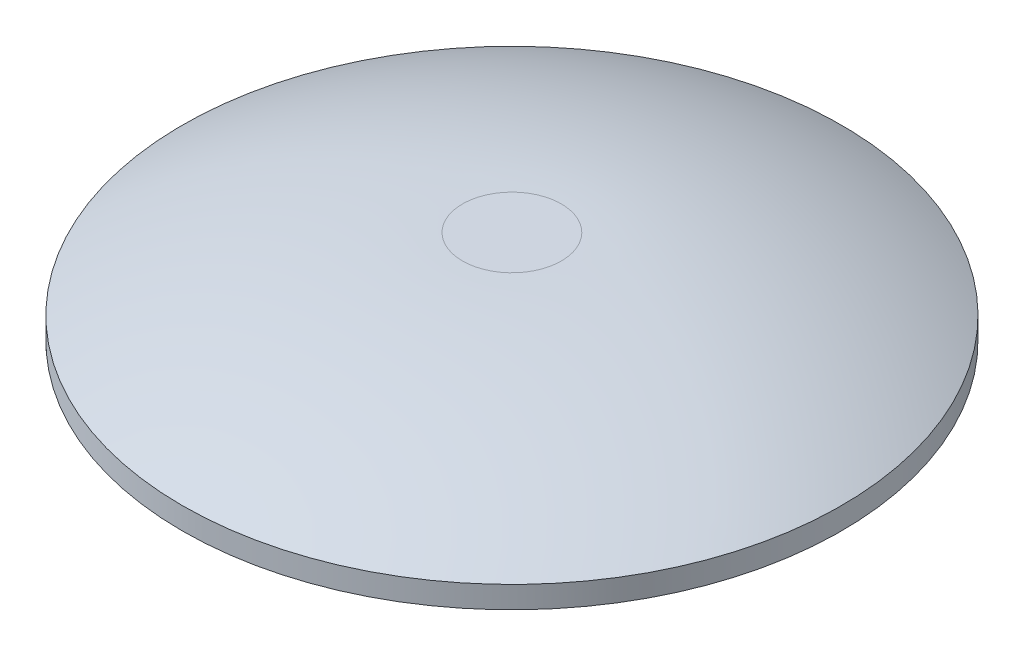
from build123d import *


with BuildPart() as part:
    # Sketch1 → Revolve1 (revolve)
    with BuildSketch(Plane.XY, mode=Mode.PRIVATE) as revolve1_sk:
        with BuildLine():
            Line((300, -65.353443934), (300, -85.353443934))
            ThreePointArc((300, -85.353443934), (176.620736051, -134.108701777), (45, -150.706887868))
            Line((45, -150.706887868), (0, -150.706887868))
            Line((0, -150.706887868), (0, 0))
            Line((0, 0), (45, 0))
            ThreePointArc((45, 0), (176.620736051, -16.598186091), (300, -65.353443934))
        make_face()
    revolve(revolve1_sk.sketch.rotate(Axis((0, 0, 0), (0, -1, 0)), 90), axis=Axis((0, 0, 0), (0, -1, 0)))


solid = part.part
